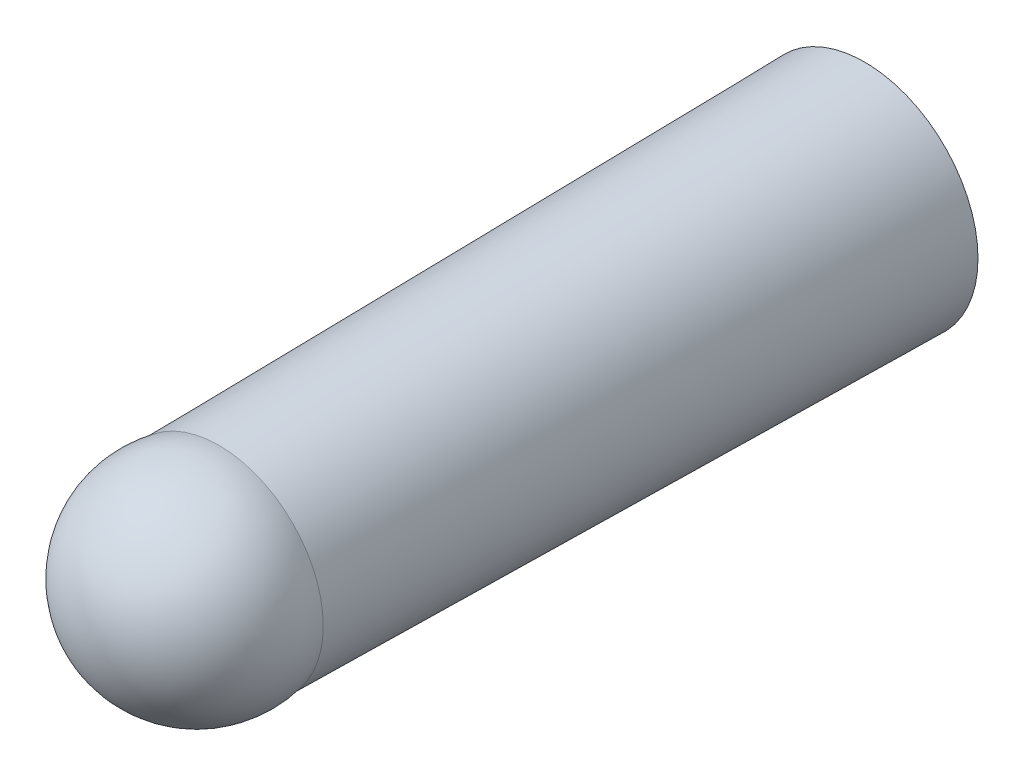
from build123d import *

# Parameters (mm, degrees)
SKETCH1_R           = 47.5
BOSS_EXTRUDE1_DEPTH = 280
BOSS_EXTRUDE1_TAPER = 0.8


with BuildPart() as part:
    # Sketch1 → Boss-Extrude1 (new body)
    with BuildSketch(Plane.XY):
        Circle(SKETCH1_R)
    extrude(amount=BOSS_EXTRUDE1_DEPTH, taper=BOSS_EXTRUDE1_TAPER)

    # Sketch2 → Cut-Revolve2 (revolve, cut)
    with BuildSketch(Plane(origin=(0, 0, 0), x_dir=(-1, 0, 0), z_dir=(0, 0, -1))):
        with BuildLine():
            Line((0, 42.5), (0, -42.5))
            ThreePointArc((0, -42.5), (42.5, 0), (0, 42.5))
        make_face()
    revolve(axis=Axis((0, 42.5, 0), (0, -1, 0)), mode=Mode.SUBTRACT)

    # Sketch3 → Revolve1 (revolve)
    with BuildSketch(Plane.XY.offset(280)):
        with BuildLine():
            Line((0, 44.70729171), (0, -44.70729171))
            ThreePointArc((0, -44.70729171), (-44.70729171, 0), (0, 44.70729171))
        make_face()
    revolve(axis=Axis((0, 44.70729171, 280), (0, -1, 0)))


solid = part.part
